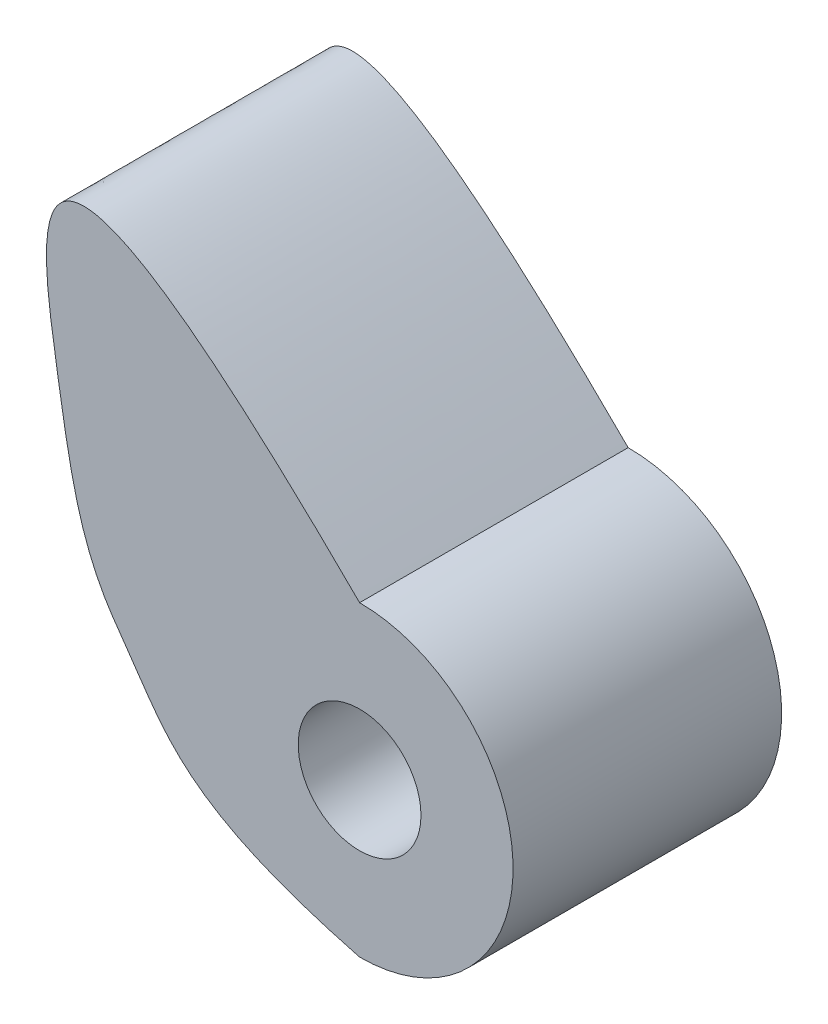
from build123d import *

# Parameters (mm, degrees)
BOSS_EXTRU_2_DEPTH = 17.5


with BuildPart() as part:
    # Esquisse1 → Boss.-Extru.2 (new body)
    # profile 1 of 3: a face of its own
    with BuildSketch(Plane.XY):
        with BuildLine():
            ThreePointArc((0, 10), (-3.464130013, 9.380821033), (-6.499276737, 7.599960651))
            ThreePointArc((-6.499276737, 7.599960651), (-9.990325494, -0.439768715), (-5.806339689, -8.141647218))
            add(Edge.make_bspline(
                [(0, -10), (-2.328489416, -9.393179028), (-4.23107576, -8.773679985), (-5.806339689, -8.141647218)],
                knots=[0, 0, 0, 0, 0.064448433, 0.064448433, 0.064448433, 0.064448433], degree=3))
            ThreePointArc((0, -10), (7.071067812, -7.071067812), (10, 0))
            ThreePointArc((10, 0), (7.071067812, 7.071067812), (0, 10))
        make_face()
        with BuildLine():
            ThreePointArc((4, 0), (-1.673492937, -3.633100795), (-2.599710695, 3.03998426))
            ThreePointArc((-2.599710695, 3.03998426), (1.673492937, 3.633100795), (4, 0))
        make_face(mode=Mode.SUBTRACT)
    # profile 2 of 3: a face of its own
    with BuildSketch(Plane.XY):
        with BuildLine():
            ThreePointArc((-5.806339689, -8.141647218), (-9.990325494, -0.439768715), (-6.499276737, 7.599960651))
            Line((-6.499276737, 7.599960651), (-19.497830211, 22.799881952))
            add(Edge.make_bspline(
                [(-5.806339689, -8.141647218), (-11.720983286, -5.768553738), (-13.360805168, -2.55255678), (-18.197994698, 3.930737949), (-19.276697497, 10.475393425), (-20.981489851, 21.277421877), (-19.497830211, 22.799881952)],
                knots=[0.064448433, 0.064448433, 0.064448433, 0.064448433, 0.306432972, 0.369658359, 0.632253871, 0.796889944, 0.796889944, 0.796889944, 0.796889944], degree=3))
        make_face()
    # profile 3 of 3: a face of its own
    with BuildSketch(Plane.XY):
        with BuildLine():
            Line((-19.497830211, 22.799881952), (-6.499276737, 7.599960651))
            ThreePointArc((-6.499276737, 7.599960651), (-3.464130013, 9.380821033), (0, 10))
            add(Edge.make_bspline(
                [(-19.497830211, 22.799881952), (-17.667452529, 24.678127387), (-12.579078556, 22.53806317), (0, 10)],
                knots=[0.796889944, 0.796889944, 0.796889944, 0.796889944, 1, 1, 1, 1], degree=3))
        make_face()
    extrude(amount=-BOSS_EXTRU_2_DEPTH)


solid = part.part
